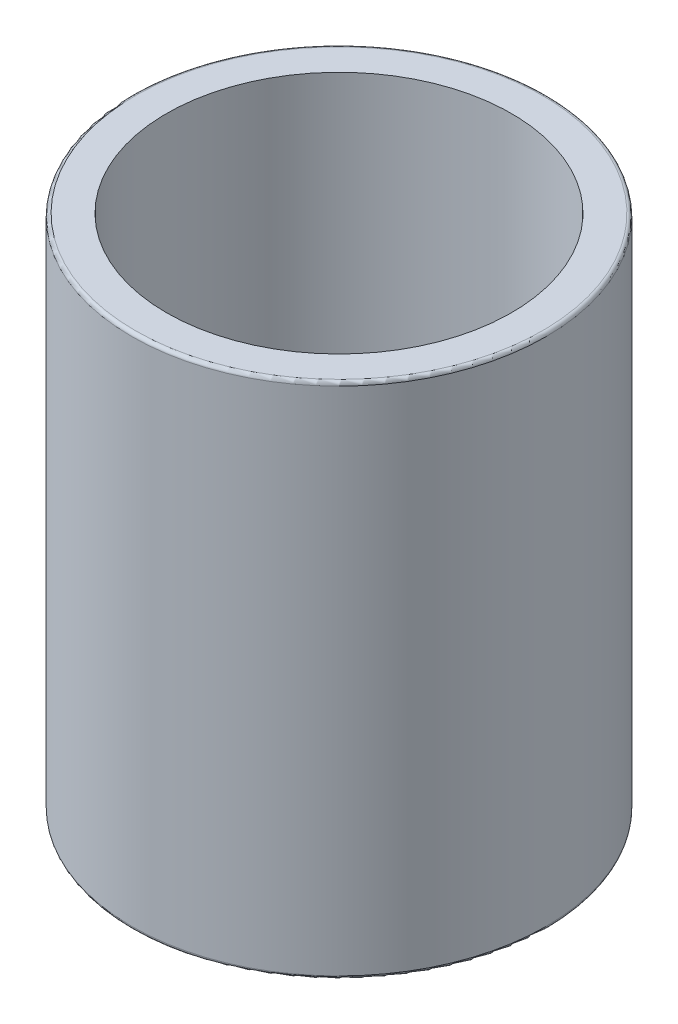
from build123d import *

# Parameters (mm, degrees)
SKIZZE1_R                       = 6
SKIZZE1_R_2                     = 5
AUFSATZ_LINEAR_AUSTRAGEN1_DEPTH = 7.5
VERRUNDUNG1_R                   = 0.1


with BuildPart() as part:
    # Skizze1 → Aufsatz-Linear austragen1 (new, symmetric)
    with BuildSketch(Plane(origin=(0, 0, 0), x_dir=(1, 0, 0), z_dir=(0, 1, 0))):
        with Locations(Location((0, 0, 0), (0, 0, 270))):
            Circle(SKIZZE1_R)
        with Locations(Location((0, 0, 0), (0, 0, 270))):
            Circle(SKIZZE1_R_2, mode=Mode.SUBTRACT)
    extrude(amount=AUFSATZ_LINEAR_AUSTRAGEN1_DEPTH, both=True)

    # Verrundung1
    verrundung1_edges = [part.edges().sort_by_distance(p)[0] for p in [
        (0, -7.5, -6),
        (0, 7.5, -6),
    ]]
    fillet(verrundung1_edges, radius=VERRUNDUNG1_R)


solid = part.part
